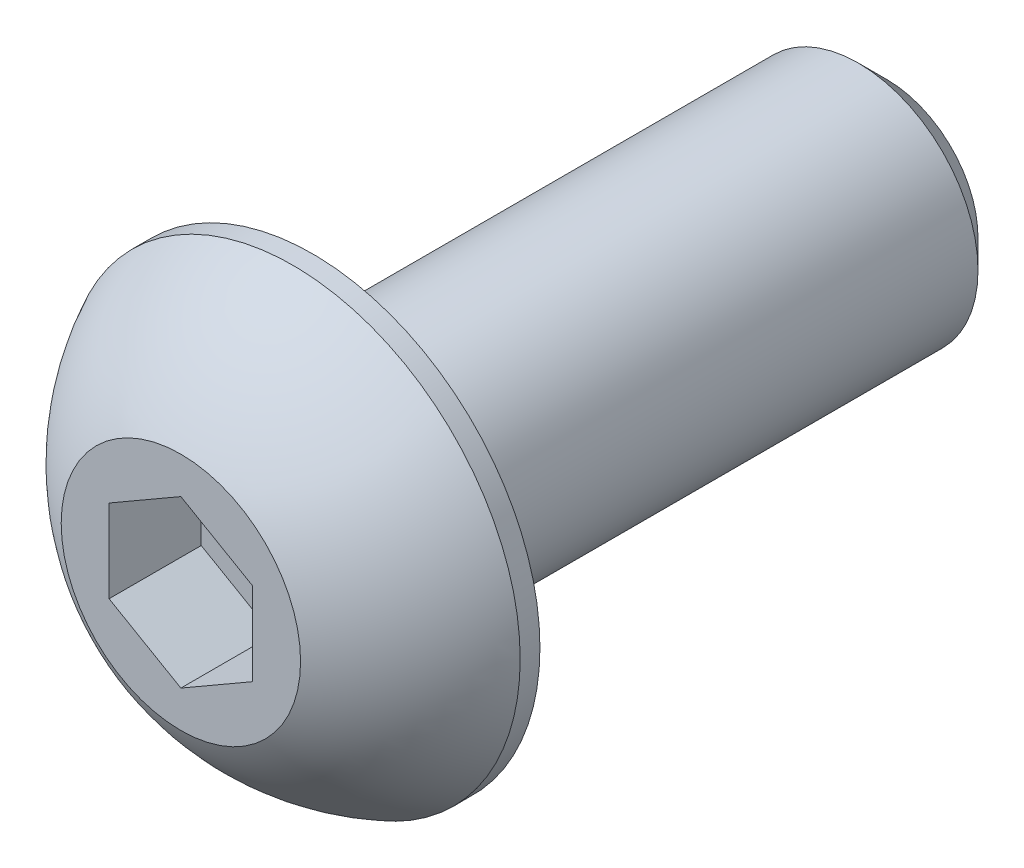
from build123d import *

# Parameters (mm, degrees)
SKETCH1_W          = 12
SKETCH1_H          = 2.5
CHAMFER1_SIZE      = 0.6
CUT_EXTRUDE2_DEPTH = 1.925


with BuildPart() as part:
    # Sketch1 → Revolve1 (revolve)
    with BuildSketch(Plane(origin=(0, 0, 0), x_dir=(0, 0, -1), z_dir=(1, 0, 0))):
        with Locations((8.75, 1.25)):
            Rectangle(SKETCH1_W, SKETCH1_H)
    revolve(axis=Axis((0, 0, -14.75), (0, 0, 1)))

    # Chamfer1
    chamfer1_edges = [part.edges().sort_by_distance(p)[0] for p in [
        (0, -2.5, -14.75),
    ]]
    chamfer(chamfer1_edges, length=CHAMFER1_SIZE)

    # Sketch7 → Revolve2 (revolve)
    with BuildSketch(Plane(origin=(0, 0, 0), x_dir=(0, 0, -1), z_dir=(1, 0, 0))):
        with BuildLine():
            Line((2.3375, 4.75), (2.75, 4.75))
            Line((2.75, 4.75), (2.75, 0))
            Line((2.75, 0), (0, 0))
            Line((0, 0), (0, 2.5))
            ThreePointArc((0, 2.5), (0.991875183, 3.808753282), (2.3375, 4.75))
        make_face()
    revolve(axis=Axis((0, 0, 0), (0, 0, -1)))

    # Sketch5 → Cut-Extrude2 (cut)
    with BuildSketch(Plane.XY):
        Polygon((1.5, -0.866025404), (1.5, 0.866025404), (0, 1.732050808), (-1.5, 0.866025404), (-1.5, -0.866025404), (0, -1.732050808), align=None)
    extrude(amount=-CUT_EXTRUDE2_DEPTH, mode=Mode.SUBTRACT)


solid = part.part
